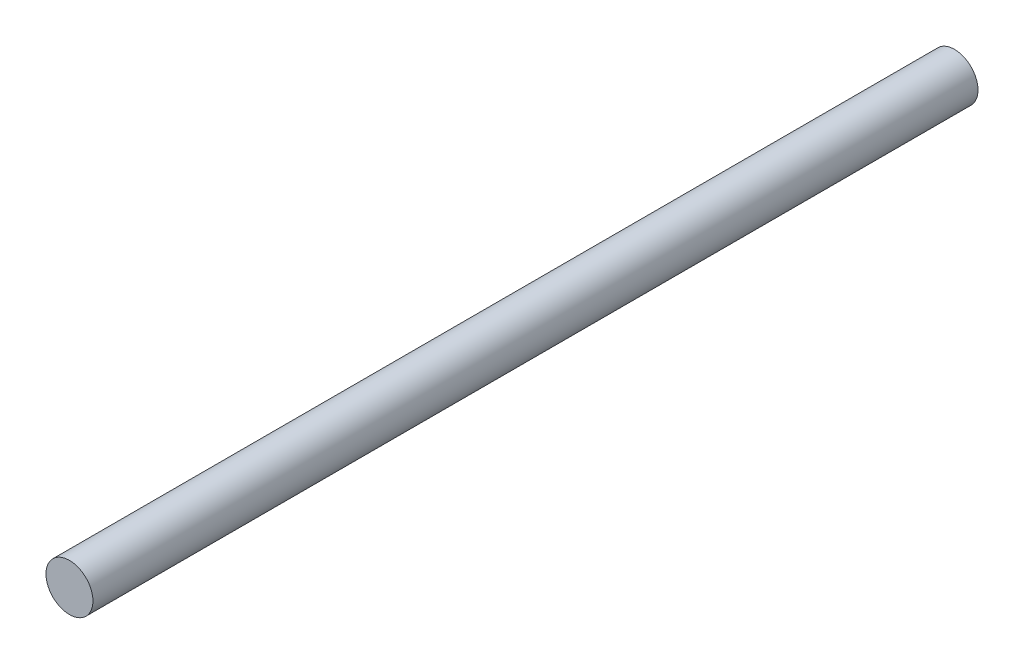
from build123d import *

# Parameters (mm, degrees)
SKETCH1_R           = 11
BOSS_EXTRUDE1_DEPTH = 414.6


with BuildPart() as part:
    # Sketch1 → Boss-Extrude1 (new body)
    with BuildSketch(Plane.XY):
        Circle(SKETCH1_R)
    extrude(amount=BOSS_EXTRUDE1_DEPTH)


solid = part.part
